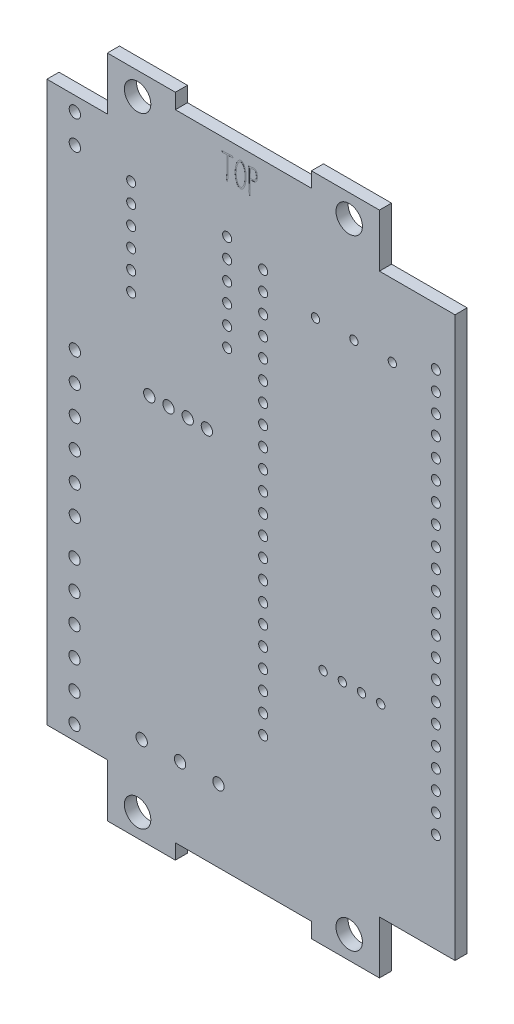
from build123d import *

# Parameters (mm, degrees)
SKETCH_1_W             = 54
SKETCH_1_H             = 88
EXTRUDE_1_DEPTH        = 1.6
SKETCH_2_R             = 1.75
CUT_EXTRUDE_1_DEPTH    = 10
SKETCH_3_R             = 0.6
CUT_EXTRUDE_2_DEPTH    = 10
PATTERN_LINEAR_1_COUNT = 22
PATTERN_LINEAR_1_PITCH = 2.54
SKETCH_4_R             = 0.75
CUT_EXTRUDE_3_DEPTH    = 10
PATTERN_LINEAR_2_COUNT = 6
PATTERN_LINEAR_2_PITCH = 3.81
SKETCH_5_R             = 0.75
CUT_EXTRUDE_4_DEPTH    = 10
PATTERN_LINEAR_3_COUNT = 2
PATTERN_LINEAR_3_PITCH = 3.81
SKETCH_6_R             = 0.6
CUT_EXTRUDE_5_DEPTH    = 10
PATTERN_LINEAR_4_COUNT = 6
PATTERN_LINEAR_4_PITCH = 2.54
SKETCH_7_W             = 8
SKETCH_7_H             = 7
SKETCH_7_W_2           = 10
CUT_EXTRUDE_6_DEPTH    = 10
SKETCH_8_R             = 0.55
CUT_EXTRUDE_7_DEPTH    = 10
SKETCH_9_R             = 0.75
CUT_EXTRUDE_8_DEPTH    = 10
SKETCH_10_W            = 18
SKETCH_10_H            = 1.6
CUT_EXTRUDE_9_DEPTH    = 2
CUT_EXTRUDE_10_DEPTH   = 0.01


with BuildPart() as part:
    # 草图1 → 凸台-拉伸1 (new body)
    with BuildSketch(Plane.XY):
        with Locations((27, 44)):
            Rectangle(SKETCH_1_W, SKETCH_1_H)
    extrude(amount=EXTRUDE_1_DEPTH)

    # 草图2 → 切除-拉伸1 (cut)
    with BuildSketch(Plane.XY.offset(1.6)):
        with Locations((12, 85)):
            Circle(SKETCH_2_R)
        with Locations((40, 85)):
            Circle(SKETCH_2_R)
        with Locations((12, 3)):
            Circle(SKETCH_2_R)
        with Locations((40, 3)):
            Circle(SKETCH_2_R)
    extrude(amount=-CUT_EXTRUDE_1_DEPTH, mode=Mode.SUBTRACT)

    # 草图3 → 切除-拉伸2 (cut)
    with BuildSketch(Plane(origin=(0, 0, 0), x_dir=(-1, 0, 0), z_dir=(0, 0, -1))):
        with Locations((-51.476, 73.476)):
            Circle(SKETCH_3_R)
        with Locations((-28.616, 73.476)):
            Circle(SKETCH_3_R)
    cut_extrude_2 = extrude(amount=-CUT_EXTRUDE_2_DEPTH, mode=Mode.SUBTRACT)

    # 阵列(线性)1: 切除-拉伸2 ×22
    with Locations(*[(0, -i * PATTERN_LINEAR_1_PITCH, 0) for i in range(1, PATTERN_LINEAR_1_COUNT)]):
        add(cut_extrude_2, mode=Mode.SUBTRACT)

    # 草图4 → 切除-拉伸3 (cut)
    with BuildSketch(Plane(origin=(0, 0, 0), x_dir=(-1, 0, 0), z_dir=(0, 0, -1))):
        with Locations((-3.7, 51.815)):
            Circle(SKETCH_4_R)
        with Locations((-3.651815313, 27.955)):
            Circle(SKETCH_4_R)
    cut_extrude_3 = extrude(amount=-CUT_EXTRUDE_3_DEPTH, mode=Mode.SUBTRACT)

    # 阵列(线性)2: 切除-拉伸3 ×6
    with Locations(*[(0, -i * PATTERN_LINEAR_2_PITCH, 0) for i in range(1, PATTERN_LINEAR_2_COUNT)]):
        add(cut_extrude_3, mode=Mode.SUBTRACT)

    # 草图5 → 切除-拉伸4 (cut)
    with BuildSketch(Plane(origin=(0, 0, 0), x_dir=(-1, 0, 0), z_dir=(0, 0, -1))):
        with Locations((-3.7, 79.095)):
            Circle(SKETCH_5_R)
    cut_extrude_4 = extrude(amount=-CUT_EXTRUDE_4_DEPTH, mode=Mode.SUBTRACT)

    # 阵列(线性)3: 切除-拉伸4 ×2
    with Locations(*[(0, -i * PATTERN_LINEAR_3_PITCH, 0) for i in range(1, PATTERN_LINEAR_3_COUNT)]):
        add(cut_extrude_4, mode=Mode.SUBTRACT)

    # 草图6 → 切除-拉伸5 (cut)
    with BuildSketch(Plane.XY.offset(1.6)):
        with Locations((11.15, 74.85)):
            Circle(SKETCH_6_R)
        with Locations((23.85, 74.85)):
            Circle(SKETCH_6_R)
    cut_extrude_5 = extrude(amount=-CUT_EXTRUDE_5_DEPTH, mode=Mode.SUBTRACT)

    # 阵列(线性)4: 切除-拉伸5 ×6
    with Locations(*[(0, -i * PATTERN_LINEAR_4_PITCH, 0) for i in range(1, PATTERN_LINEAR_4_COUNT)]):
        add(cut_extrude_5, mode=Mode.SUBTRACT)

    # 草图7 → 切除-拉伸6 (cut)
    with BuildSketch(Plane.XY.offset(1.6)):
        with Locations((4, 84.5)):
            Rectangle(SKETCH_7_W, SKETCH_7_H)
        with Locations((49, 84.5)):
            Rectangle(SKETCH_7_W_2, SKETCH_7_H)
        with Locations((4, 3.5)):
            Rectangle(SKETCH_7_W, SKETCH_7_H)
        with Locations((49, 3.5)):
            Rectangle(SKETCH_7_W_2, SKETCH_7_H)
    extrude(amount=-CUT_EXTRUDE_6_DEPTH, mode=Mode.SUBTRACT)

    # 草图8 → 切除-拉伸7 (cut)
    with BuildSketch(Plane(origin=(0, 0, 0), x_dir=(-1, 0, 0), z_dir=(0, 0, -1))):
        with Locations((-45.7, 71.4)):
            Circle(SKETCH_8_R)
        with Locations((-40.62, 71.4)):
            Circle(SKETCH_8_R)
        with Locations((-35.54, 71.4)):
            Circle(SKETCH_8_R)
        with Locations((-44.17, 31.5)):
            Circle(SKETCH_8_R)
        with Locations((-41.63, 31.5)):
            Circle(SKETCH_8_R)
        with Locations((-39.09, 31.5)):
            Circle(SKETCH_8_R)
        with Locations((-36.55, 31.5)):
            Circle(SKETCH_8_R)
    extrude(amount=-CUT_EXTRUDE_7_DEPTH, mode=Mode.SUBTRACT)

    # 草图9 → 切除-拉伸8 (cut)
    with BuildSketch(Plane.XY.offset(1.6)):
        with Locations((13.55, 51.5)):
            Circle(SKETCH_9_R)
        with Locations((16.09, 51.5)):
            Circle(SKETCH_9_R)
        with Locations((18.63, 51.5)):
            Circle(SKETCH_9_R)
        with Locations((21.17, 51.5)):
            Circle(SKETCH_9_R)
        with Locations((12.54, 11.6)):
            Circle(SKETCH_9_R)
        with Locations((17.62, 11.6)):
            Circle(SKETCH_9_R)
        with Locations((22.7, 11.6)):
            Circle(SKETCH_9_R)
    extrude(amount=-CUT_EXTRUDE_8_DEPTH, mode=Mode.SUBTRACT)

    # 草图10 → 切除-拉伸9 (cut)
    with BuildSketch(Plane.XZ):
        with Locations((26, 0.8)):
            Rectangle(SKETCH_10_W, SKETCH_10_H)
    cut_extrude_9 = extrude(amount=-CUT_EXTRUDE_9_DEPTH, mode=Mode.SUBTRACT)

    # 镜向1: 切除-拉伸9 across plane
    add(cut_extrude_9.mirror(Plane(origin=(0, 44, 0), x_dir=(0, 0, 1), z_dir=(0, -1, 0))), mode=Mode.SUBTRACT)

    # 草图11 → 切除-拉伸10 (cut)
    # profile 1 of 3: a face of its own
    with BuildSketch(Plane.XY.offset(1.6)):
        with BuildLine():
            Line((23.946203667, 84.253386462), (23.946203667, 81.827326372))
            Line((23.946203667, 81.827326372), (23.920846753, 81.32913758))
            add(Edge.make_bspline(
                [(23.920846753, 81.32913758), (23.920548353, 81.304904906), (23.92001296, 81.261426403), (23.911582799, 81.212251038), (23.903393411, 81.181574075), (23.897639878, 81.169799284), (23.892171246, 81.159755543), (23.887637437, 81.161938664), (23.885794547, 81.162826052)],
                knots=[0, 0, 0, 0, 2.43675652, 4.372052466, 5.078871199, 5.550454925, 5.817270194, 6, 6, 6, 6], degree=3))
            add(Edge.make_bspline(
                [(23.885794547, 81.162826052), (23.883537477, 81.163504176), (23.877975169, 81.165175338), (23.867027939, 81.171285005), (23.85586361, 81.190509774), (23.845072003, 81.219144375), (23.832987434, 81.251610623), (23.82769733, 81.273902297), (23.825385427, 81.283644292)],
                knots=[0, 0, 0, 0, 0.30288637, 0.746430801, 1.570370807, 3.058663464, 4.714565407, 6, 6, 6, 6], degree=3))
            Line((23.825385427, 81.283644292), (23.764976307, 81.464871652))
            add(Edge.make_bspline(
                [(23.764976307, 81.464871652), (23.759199213, 81.480755493), (23.749043375, 81.508678473), (23.736553272, 81.545304919), (23.729958825, 81.57141685), (23.727913131, 81.594431308), (23.738044829, 81.618574846), (23.750062124, 81.650059153), (23.763438221, 81.686798885), (23.7733009, 81.727529231), (23.779596364, 81.772050205), (23.785818669, 81.824017101), (23.791785262, 81.889190561), (23.798387153, 81.970698738), (23.805050132, 82.068119929), (23.805180465, 82.138058945), (23.805249054, 82.17486526)],
                knots=[0, 0, 0, 0, 0.980641267, 1.723917205, 2.241620292, 2.544775778, 3.041991924, 3.722164793, 4.515637936, 5.302532678, 6.148880555, 7.121858782, 8.338588997, 9.944421189, 11.865699026, 14, 14, 14, 14], degree=3))
            Line((23.805249054, 82.17486526), (23.805249054, 84.248911712))
            add(Edge.make_bspline(
                [(23.805249054, 84.248911712), (23.79107152, 84.248849536), (23.764933554, 84.248734907), (23.731169156, 84.246123664), (23.698830899, 84.24421087), (23.661298385, 84.241099072), (23.609342334, 84.23662402), (23.548736267, 84.230802575), (23.489233264, 84.226594192), (23.441838778, 84.221619316), (23.411236238, 84.219358837), (23.396555777, 84.218573625), (23.392080505, 84.218334256)],
                knots=[0, 0, 0, 0, 1.025992475, 1.891538789, 2.450608741, 3.371279513, 4.617765367, 6.225964987, 7.778834079, 8.935698997, 9.675552692, 10, 10, 10, 10], degree=3))
            Line((23.392080505, 84.218334256), (23.291398639, 84.203418424))
            Line((23.291398639, 84.203418424), (23.120612361, 84.349593579))
            add(Edge.make_bspline(
                [(23.120612361, 84.349593579), (23.112512354, 84.357440106), (23.099997147, 84.369563664), (23.088213517, 84.389567971), (23.091804748, 84.403076725), (23.09722145, 84.414206708), (23.112306384, 84.419661584), (23.123625571, 84.419684476), (23.130307652, 84.419697989)],
                knots=[0, 0, 0, 0, 1.88901374, 2.918688365, 3.546721585, 4.117087209, 4.888455958, 6, 6, 6, 6], degree=3))
            add(Edge.make_bspline(
                [(23.130307652, 84.419697989), (23.133526906, 84.418867821), (23.144241804, 84.416104706), (23.167915243, 84.416192105), (23.204832478, 84.413754659), (23.234205056, 84.41421326), (23.251125892, 84.414477448)],
                knots=[0, 0, 0, 0, 0.328519165, 1.093436259, 2.325598431, 4, 4, 4, 4], degree=3))
            Line((23.251125892, 84.414477448), (23.331671385, 84.410002699))
            add(Edge.make_bspline(
                [(23.331671385, 84.410002699), (23.334639075, 84.409129808), (23.3440847, 84.406351555), (23.365082969, 84.408647922), (23.397289011, 84.406981679), (23.422897032, 84.408902065), (23.437573793, 84.410002699)],
                knots=[0, 0, 0, 0, 0.347341643, 1.105526146, 2.341086076, 4, 4, 4, 4], degree=3))
            Line((23.437573793, 84.410002699), (23.543476201, 84.410002699))
            Line((23.543476201, 84.410002699), (23.805249054, 84.419697989))
            Line((23.805249054, 84.419697989), (24.016308078, 84.424918531))
            add(Edge.make_bspline(
                [(24.016308078, 84.424918531), (24.034486262, 84.425587717), (24.076752059, 84.427143631), (24.14507144, 84.438315014), (24.221531959, 84.44896941), (24.285937463, 84.456648161), (24.33270505, 84.460557845), (24.358926759, 84.465419991), (24.377311241, 84.468898807), (24.386013642, 84.473280332), (24.38920388, 84.474886568)],
                knots=[0, 0, 0, 0, 1.156915626, 2.689925566, 4.399695503, 6.072075551, 6.820020126, 7.381954211, 7.77342877, 8, 8, 8, 8], degree=3))
            Line((24.38920388, 84.474886568), (24.495106288, 84.515159315))
            Line((24.495106288, 84.515159315), (24.640535651, 84.333931955))
            add(Edge.make_bspline(
                [(24.640535651, 84.333931955), (24.647259467, 84.324485921), (24.657901334, 84.309535566), (24.668230489, 84.289529085), (24.669551475, 84.276794519), (24.667211491, 84.26765288), (24.657888747, 84.265377605), (24.64608098, 84.265609037), (24.627866597, 84.263085328), (24.613683022, 84.26355565), (24.605483446, 84.263827544)],
                knots=[0, 0, 0, 0, 2.075716626, 3.285262792, 3.906827215, 4.383787294, 4.762155351, 5.472092002, 6.53860716, 8, 8, 8, 8], degree=3))
            Line((24.605483446, 84.263827544), (24.499581038, 84.263827544))
            Line((24.499581038, 84.263827544), (24.122210486, 84.258607003))
            add(Edge.make_bspline(
                [(24.122210486, 84.258607003), (24.103318047, 84.25945899), (24.069271704, 84.260994368), (24.024281117, 84.261655882), (23.99111226, 84.261662146), (23.973292886, 84.259464493), (23.966340041, 84.258607003)],
                knots=[0, 0, 0, 0, 1.454015493, 2.620302767, 3.461663352, 4, 4, 4, 4], degree=3))
            Line((23.966340041, 84.258607003), (23.946203667, 84.253386462))
        make_face()
    # profile 2 of 3: a face of its own
    with BuildSketch(Plane.XY.offset(1.6)):
        with BuildLine():
            add(Edge.make_bspline(
                [(24.909020629, 82.940047446), (24.912086765, 82.988311022), (24.918404761, 83.087761642), (24.936283092, 83.240411626), (24.959387009, 83.401111761), (24.988246884, 83.566309578), (25.02434973, 83.729993524), (25.073637912, 83.883346865), (25.132398173, 84.024610333), (25.201820768, 84.149965957), (25.274579775, 84.258144183), (25.344860313, 84.346535629), (25.411014662, 84.414496524), (25.476195663, 84.460201615), (25.53826078, 84.488422047), (25.595198888, 84.508023583), (25.648523734, 84.52080327), (25.683091186, 84.520516485), (25.69955973, 84.520379856)],
                knots=[0, 0, 0, 0, 1.217793816, 2.509352989, 3.869389901, 5.306369188, 6.732518591, 8.086865491, 9.357865112, 10.57959578, 11.689225504, 12.637700741, 13.421327601, 14.069152645, 14.629329011, 15.132240194, 15.586583926, 16, 16, 16, 16], degree=3))
            add(Edge.make_bspline(
                [(25.69955973, 84.520379856), (25.715351237, 84.517639704), (25.748928268, 84.511813397), (25.799988327, 84.49176184), (25.855162508, 84.464276107), (25.913072758, 84.427050286), (25.971261421, 84.379652722), (26.026287318, 84.319898489), (26.075987202, 84.247392277), (26.137188765, 84.134643104), (26.20378084, 83.979752206), (26.256312045, 83.815126139), (26.290379881, 83.676329753), (26.313881691, 83.565494459), (26.33283001, 83.448442303), (26.354465706, 83.285382381), (26.373920535, 83.078190086), (26.370822349, 82.911750362), (26.36928059, 82.828924497)],
                knots=[0, 0, 0, 0, 0.394985608, 0.839846589, 1.347857167, 1.916750551, 2.536277094, 3.196746505, 3.915575437, 4.701623328, 6.36253532, 8.071356979, 8.963406565, 9.891884595, 10.869033514, 11.891140732, 13.955296867, 16, 16, 16, 16], degree=3))
            add(Edge.make_bspline(
                [(26.36928059, 82.828924497), (26.367988566, 82.797839384), (26.36530843, 82.733357393), (26.357176564, 82.633807027), (26.343748982, 82.52826258), (26.323652528, 82.378875001), (26.286005019, 82.18772417), (26.233964569, 81.998357618), (26.182819029, 81.850215724), (26.138902686, 81.744663443), (26.090353476, 81.644489686), (26.036669664, 81.552102685), (25.98089168, 81.468956052), (25.921139455, 81.400029467), (25.860745802, 81.344654394), (25.797812486, 81.305599881), (25.73704322, 81.27902585), (25.680684936, 81.26054032), (25.628004158, 81.251474621), (25.594675132, 81.252551846), (25.57874149, 81.253066837)],
                knots=[0, 0, 0, 0, 0.881282943, 1.828105941, 2.82824081, 3.894865892, 6.097710261, 8.340987808, 9.452332789, 10.535200188, 11.577677107, 12.603151353, 13.560288859, 14.408919748, 15.182050945, 15.871786862, 16.496001568, 17.057257397, 17.549302039, 18, 18, 18, 18], degree=3))
            add(Edge.make_bspline(
                [(25.57874149, 81.253066837), (25.562227913, 81.255028942), (25.527562477, 81.259147809), (25.474654907, 81.276715386), (25.418752344, 81.303204886), (25.359683553, 81.338806467), (25.29988313, 81.386700548), (25.244375308, 81.450855111), (25.190365815, 81.528180114), (25.140831907, 81.619702695), (25.094499668, 81.721473242), (25.053070998, 81.831298702), (25.015701126, 81.947268988), (24.983237361, 82.067973047), (24.957223546, 82.190621396), (24.934968466, 82.310861541), (24.920466659, 82.427698105), (24.910311644, 82.540135688), (24.906717234, 82.647925202), (24.904036272, 82.750349123), (24.904578156, 82.847119004), (24.907571072, 82.909725361), (24.909020629, 82.940047446)],
                knots=[0, 0, 0, 0, 0.510534934, 1.071719088, 1.704710998, 2.411693894, 3.189282936, 4.05053371, 5.011670478, 6.086573801, 7.246791516, 8.449877322, 9.695482973, 10.994127406, 12.29322218, 13.551907867, 14.754774865, 15.913908135, 17.0238299, 18.071869134, 19.066149983, 20, 20, 20, 20], degree=3))
        make_face()
        with BuildLine():
            add(Edge.make_bspline(
                [(25.055195783, 82.929606364), (25.053784308, 82.904753182), (25.050807797, 82.852342915), (25.049658046, 82.769510951), (25.050327687, 82.678494622), (25.055120051, 82.54495623), (25.07249237, 82.368677194), (25.103107008, 82.190372061), (25.137567469, 82.048431664), (25.167297523, 81.946691444), (25.199980917, 81.850350054), (25.236737304, 81.761395399), (25.275788599, 81.681183303), (25.31888769, 81.613682092), (25.361983007, 81.556879934), (25.40993267, 81.515418322), (25.456329003, 81.483312754), (25.501195626, 81.461518216), (25.542864486, 81.444798161), (25.570655967, 81.44122534), (25.583962031, 81.439514738)],
                knots=[0, 0, 0, 0, 0.796536737, 1.679732718, 2.650327695, 3.709147218, 5.954918549, 8.313069364, 9.492003862, 10.627402775, 11.704181224, 12.745734999, 13.706334556, 14.553839847, 15.30675304, 15.97732542, 16.573080319, 17.10674674, 17.572326302, 18, 18, 18, 18], degree=3))
            add(Edge.make_bspline(
                [(25.583962031, 81.439514738), (25.597662122, 81.438708411), (25.626020322, 81.437039374), (25.669585194, 81.445594169), (25.715172834, 81.460644606), (25.762382668, 81.484923689), (25.811306352, 81.519609333), (25.858099876, 81.569702707), (25.904780955, 81.632805266), (25.950577622, 81.707976803), (25.99462089, 81.79134402), (26.033747998, 81.88066021), (26.07012502, 81.97289811), (26.110036398, 82.102202864), (26.154044455, 82.268529256), (26.188635348, 82.471681121), (26.212723375, 82.669847517), (26.225558387, 82.830721958), (26.227467371, 82.958702996), (26.224944693, 83.061918169), (26.219265676, 83.17413072), (26.211969911, 83.251810987), (26.208189604, 83.292061083)],
                knots=[0, 0, 0, 0, 0.389303871, 0.805830913, 1.253424913, 1.753499798, 2.311288848, 2.951911425, 3.695005091, 4.54345845, 5.455166886, 6.377091015, 7.318103512, 8.276048787, 10.227707478, 12.21152619, 14.136557685, 15.91040834, 16.802233067, 17.779101204, 18.849239395, 20, 20, 20, 20], degree=3))
            add(Edge.make_bspline(
                [(26.208189604, 83.292061083), (26.204029059, 83.328648461), (26.195942698, 83.399759048), (26.179065745, 83.50208433), (26.161751952, 83.597574898), (26.133458675, 83.714573183), (26.092536255, 83.85605102), (26.039919439, 83.99157141), (25.991953686, 84.093504675), (25.953288336, 84.159736026), (25.909260054, 84.213540144), (25.863273668, 84.25618058), (25.816579352, 84.288025854), (25.7726946, 84.312563696), (25.730370536, 84.32843961), (25.702399435, 84.332163729), (25.689118647, 84.333931955)],
                knots=[0, 0, 0, 0, 1.251575308, 2.432539829, 3.524812851, 4.549720602, 6.523204923, 8.527303315, 9.483611249, 10.351763581, 11.126540771, 11.838283349, 12.475927762, 13.043152764, 13.545685196, 14, 14, 14, 14], degree=3))
            add(Edge.make_bspline(
                [(25.689118647, 84.333931955), (25.67615941, 84.332990461), (25.648696978, 84.330995304), (25.60589031, 84.321402696), (25.561406184, 84.302118519), (25.511636288, 84.278849961), (25.459139303, 84.239637411), (25.405970485, 84.180490102), (25.350019691, 84.102009431), (25.290222722, 84.006685003), (25.23295386, 83.894851393), (25.186135515, 83.767298875), (25.14521792, 83.627982369), (25.117077997, 83.47876513), (25.093657787, 83.32942769), (25.076211326, 83.186817969), (25.061736675, 83.054884215), (25.057312959, 82.970156682), (25.055195783, 82.929606364)],
                knots=[0, 0, 0, 0, 0.37757334, 0.800130614, 1.267198275, 1.784369715, 2.394414205, 3.156344445, 4.08734282, 5.194407036, 6.425938495, 7.73207238, 9.1388751, 10.642807986, 12.142427514, 13.533772035, 14.819671431, 16, 16, 16, 16], degree=3))
        make_face(mode=Mode.SUBTRACT)
    # profile 3 of 3: a face of its own
    with BuildSketch(Plane.XY.offset(1.6)):
        with BuildLine():
            add(Edge.make_bspline(
                [(26.939811168, 84.419697989), (26.978381949, 84.426214495), (27.052388033, 84.438717768), (27.159794194, 84.460121568), (27.263465131, 84.478182997), (27.332525192, 84.482941756), (27.367149757, 84.485327651)],
                knots=[0, 0, 0, 0, 1.084781132, 2.081378719, 3.038062992, 4, 4, 4, 4], degree=3))
            add(Edge.make_bspline(
                [(27.367149757, 84.485327651), (27.387052725, 84.485757492), (27.424952822, 84.486576015), (27.478621672, 84.481089668), (27.526565838, 84.472156662), (27.568947308, 84.455749587), (27.607857085, 84.433578603), (27.645132555, 84.404334335), (27.681392022, 84.367750073), (27.716751622, 84.32324727), (27.749808956, 84.270425722), (27.777151159, 84.207235682), (27.800453237, 84.134897268), (27.821173827, 84.026742246), (27.841484608, 83.890426469), (27.848495199, 83.756032935), (27.848764646, 83.655478184), (27.845801508, 83.586797021), (27.840223941, 83.523252072), (27.833510919, 83.48295142), (27.830286344, 83.463593152)],
                knots=[0, 0, 0, 0, 0.834042403, 1.588219797, 2.258865872, 2.872645434, 3.484296274, 4.130763207, 4.85321558, 5.639635085, 6.510463327, 7.457868132, 8.519533185, 9.691141985, 12.070813463, 14.294972691, 15.327100164, 16.287155067, 17.177241371, 18, 18, 18, 18], degree=3))
            add(Edge.make_bspline(
                [(27.830286344, 83.463593152), (27.826179138, 83.44088659), (27.818173106, 83.396625482), (27.80036807, 83.333407921), (27.781647602, 83.273946059), (27.758304626, 83.220217012), (27.733780403, 83.170757972), (27.706307248, 83.127244414), (27.677158686, 83.0882585), (27.635237515, 83.045875842), (27.578931577, 83.002986169), (27.505124997, 82.969959963), (27.430490422, 82.954011545), (27.381379055, 82.951141082), (27.357454466, 82.949742737)],
                knots=[0, 0, 0, 0, 1.080384674, 2.105956013, 3.074594822, 3.998289199, 4.84730105, 5.658400013, 6.406150959, 7.122683501, 8.445750941, 9.696890862, 10.878041055, 12, 12, 12, 12], degree=3))
            Line((27.357454466, 82.949742737), (27.161311274, 82.940047446))
            Line((27.161311274, 82.940047446), (26.899538421, 82.904249449))
            Line((26.899538421, 82.904249449), (26.89431788, 81.555112436))
            add(Edge.make_bspline(
                [(26.89431788, 81.555112436), (26.893751611, 81.525273575), (26.892732076, 81.471550375), (26.889044648, 81.400007248), (26.887689129, 81.345970093), (26.883201108, 81.296062143), (26.878018313, 81.24086762), (26.870697434, 81.188327116), (26.865030797, 81.146726869), (26.859041914, 81.127196161), (26.85372481, 81.110595348), (26.846303434, 81.111707646), (26.843604051, 81.112112223)],
                knots=[0, 0, 0, 0, 1.96874048, 3.54460707, 4.726507013, 5.532831549, 6.851459339, 8.37313705, 9.071482733, 9.549088405, 9.835989539, 10, 10, 10, 10], degree=3))
            add(Edge.make_bspline(
                [(26.843604051, 81.112112223), (26.842615059, 81.112863036), (26.838381934, 81.116076695), (26.828040218, 81.12278369), (26.817521595, 81.142104977), (26.811927551, 81.158283641), (26.808551845, 81.168046594)],
                knots=[0, 0, 0, 0, 0.220639879, 0.944392497, 2.156105254, 4, 4, 4, 4], degree=3))
            Line((26.808551845, 81.168046594), (26.783194931, 81.232930463))
            Line((26.783194931, 81.232930463), (26.722785811, 81.414157823))
            add(Edge.make_bspline(
                [(26.722785811, 81.414157823), (26.717151954, 81.431573438), (26.707334986, 81.461920057), (26.693695808, 81.50087545), (26.687026759, 81.52717571), (26.683241991, 81.547794506), (26.692311484, 81.568215142), (26.703717041, 81.595967339), (26.719461958, 81.632312843), (26.730761218, 81.677189343), (26.741545741, 81.725215093), (26.751319119, 81.775824222), (26.757356717, 81.831398612), (26.758940767, 81.884491601), (26.758145313, 81.936969717), (26.760680781, 81.989396211), (26.760388853, 82.053071322), (26.762124987, 82.09929539), (26.763058558, 82.124151431)],
                knots=[0, 0, 0, 0, 1.21093634, 2.110050319, 2.719907809, 3.017552618, 3.464624392, 4.142243825, 5.027278712, 6.067997939, 7.196380019, 8.282686609, 9.473265847, 10.887508473, 11.791416163, 12.942313598, 14.355792079, 16, 16, 16, 16], degree=3))
            Line((26.763058558, 82.124151431), (26.77349964, 84.198197883))
            add(Edge.make_bspline(
                [(26.77349964, 84.198197883), (26.762731725, 84.219816417), (26.742944282, 84.259543285), (26.71057092, 84.309795569), (26.685418463, 84.348071012), (26.67263807, 84.378424651), (26.668965517, 84.401204022), (26.668020588, 84.413975846), (26.667597232, 84.419697989)],
                knots=[0, 0, 0, 0, 1.750659444, 3.217064329, 4.333728491, 5.070582308, 5.583594197, 6, 6, 6, 6], degree=3))
            add(Edge.make_bspline(
                [(26.667597232, 84.419697989), (26.668269455, 84.422652118), (26.669818337, 84.429458786), (26.681723378, 84.435357425), (26.698128085, 84.435488167), (26.710843566, 84.43493732), (26.718311061, 84.434613821)],
                knots=[0, 0, 0, 0, 0.599620471, 1.381597738, 2.462275397, 4, 4, 4, 4], degree=3))
            Line((26.718311061, 84.434613821), (26.768279099, 84.424918531))
            Line((26.768279099, 84.424918531), (26.939811168, 84.419697989))
        make_face()
        with BuildLine():
            Line((26.899538421, 83.081002059), (27.236636226, 83.116054265))
            add(Edge.make_bspline(
                [(27.236636226, 83.116054265), (27.267006149, 83.119153811), (27.331133765, 83.12569866), (27.412162166, 83.140531643), (27.477535666, 83.160253601), (27.523925794, 83.18014774), (27.564444224, 83.206696789), (27.600542321, 83.238363693), (27.630568782, 83.277550092), (27.656625863, 83.32334016), (27.674334586, 83.378050127), (27.693040027, 83.460707408), (27.706646598, 83.572294503), (27.708517971, 83.663432058), (27.709468104, 83.709704382)],
                knots=[0, 0, 0, 0, 1.242290402, 2.623158502, 3.343124827, 4.017967388, 4.668958523, 5.306607609, 5.962297971, 6.668776287, 7.439809609, 8.291324773, 10.117032856, 12, 12, 12, 12], degree=3))
            add(Edge.make_bspline(
                [(27.709468104, 83.709704382), (27.707475269, 83.739060849), (27.703583746, 83.796386916), (27.693844513, 83.879487547), (27.681505348, 83.957774452), (27.664856037, 84.029787801), (27.647732187, 84.095027034), (27.624806888, 84.149960427), (27.600853404, 84.195457574), (27.57259652, 84.23163878), (27.53868156, 84.258147886), (27.501124236, 84.280828446), (27.456081336, 84.294994516), (27.424142842, 84.300971329), (27.407422504, 84.304100291)],
                knots=[0, 0, 0, 0, 1.450841259, 2.833141438, 4.12506739, 5.356415584, 6.477956507, 7.445537896, 8.28503356, 9.008768821, 9.688489171, 10.397114349, 11.160862483, 12, 12, 12, 12], degree=3))
            add(Edge.make_bspline(
                [(27.407422504, 84.304100291), (27.385048129, 84.305283987), (27.339533029, 84.307691922), (27.269251751, 84.303014808), (27.195873671, 84.294709125), (27.1463256, 84.284138262), (27.121038528, 84.278743376)],
                knots=[0, 0, 0, 0, 0.931107193, 1.894105981, 2.925247858, 4, 4, 4, 4], degree=3))
            Line((27.121038528, 84.278743376), (26.914454253, 84.233250088))
            Line((26.914454253, 84.233250088), (26.899538421, 83.081002059))
        make_face(mode=Mode.SUBTRACT)
    extrude(amount=-CUT_EXTRUDE_10_DEPTH, mode=Mode.SUBTRACT)


solid = part.part
